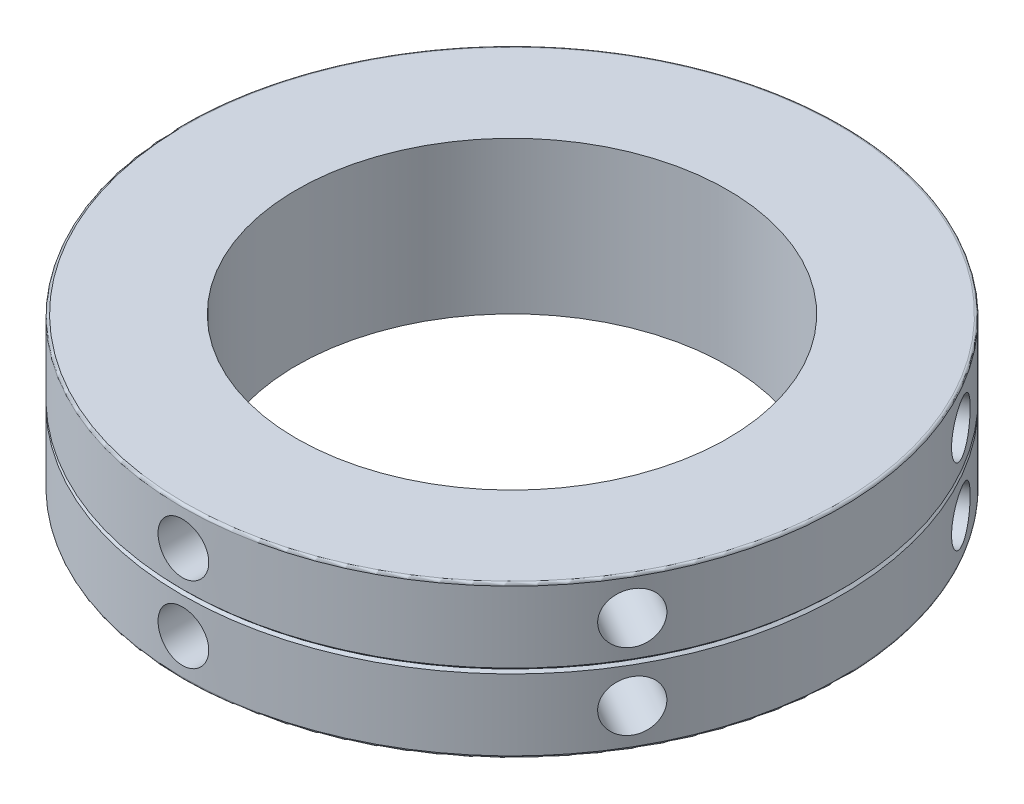
from build123d import *

# Parameters (mm, degrees)
SKETCH1_R                 = 26
SKETCH1_R_2               = 17
BOSS_EXTRUDE1_DEPTH       = 6
FILLET1_R                 = 0.2
CUT_EXTRUDE1_START        = 18
SKETCH4_R                 = 2
CUT_EXTRUDE1_DEPTH        = 12
CIRPATTERN1_COUNT         = 6
LPATTERN1_START           = 18
LPATTERN1_COPY_1_SKETCH_R = 2
LPATTERN1_COPY_1_DEPTH    = 12
LPATTERN1_COPY_2_SKETCH_R = 2
LPATTERN1_COPY_2_DEPTH    = 12
LPATTERN1_COPY_3_SKETCH_R = 2
LPATTERN1_COPY_3_DEPTH    = 12
LPATTERN1_COPY_4_SKETCH_R = 2
LPATTERN1_COPY_4_DEPTH    = 12
LPATTERN1_COPY_5_SKETCH_R = 2
LPATTERN1_COPY_5_DEPTH    = 12
LPATTERN1_COPY_6_SKETCH_R = 2
LPATTERN1_COPY_6_DEPTH    = 12


with BuildPart() as part:
    # Sketch1 → Boss-Extrude1 (new, symmetric)
    with BuildSketch(Plane(origin=(0, 0, 0), x_dir=(1, 0, 0), z_dir=(0, 1, 0))):
        Circle(SKETCH1_R)
        Circle(SKETCH1_R_2, mode=Mode.SUBTRACT)
    extrude(amount=BOSS_EXTRUDE1_DEPTH, both=True)

    # Sketch3 → Cut-Revolve1 (revolve, cut)
    with BuildSketch(Plane.XY):
        Polygon((-26, 0.2), (-26, -0.2), (-25.8, 0), align=None)
    revolve(axis=Axis((0, -6, 0), (0, 1, 0)), mode=Mode.SUBTRACT)

    # Fillet1
    fillet1_edges = [part.edges().sort_by_distance(p)[0] for p in [
        (-26, -6, 0),
        (-26, 6, 0),
    ]]
    fillet(fillet1_edges, radius=FILLET1_R)

    # Sketch4 → Cut-Extrude1 (cut)
    with BuildSketch(Plane.XY.offset(CUT_EXTRUDE1_START)):
        with Locations((0, 3)):
            Circle(SKETCH4_R)
    cut_extrude1 = extrude(amount=CUT_EXTRUDE1_DEPTH, mode=Mode.SUBTRACT)

    # CirPattern1: Cut-Extrude1 ×6 about axis
    cirpattern1_axis = Axis((0, 6, 0), (0, -1, 0))
    for i in range(1, CIRPATTERN1_COUNT):
        add(cut_extrude1.rotate(cirpattern1_axis, i * 360 / CIRPATTERN1_COUNT), mode=Mode.SUBTRACT)

    # LPattern1 copy 1 sketch → LPattern1 copy 1 (cut)
    with BuildSketch(Plane(origin=(0, -6, 0), x_dir=(0.5000000000000001, 0, 0.8660254037844386), z_dir=(-0.8660254037844386, 0, 0.5000000000000001)).offset(LPATTERN1_START)):
        with Locations((0, 3)):
            Circle(LPATTERN1_COPY_1_SKETCH_R)
    extrude(amount=LPATTERN1_COPY_1_DEPTH, mode=Mode.SUBTRACT)

    # LPattern1 copy 2 sketch → LPattern1 copy 2 (cut)
    with BuildSketch(Plane(origin=(0, -6, 0), x_dir=(-0.4999999999999998, 0, 0.8660254037844387), z_dir=(-0.8660254037844387, 0, -0.4999999999999998)).offset(LPATTERN1_START)):
        with Locations((0, 3)):
            Circle(LPATTERN1_COPY_2_SKETCH_R)
    extrude(amount=LPATTERN1_COPY_2_DEPTH, mode=Mode.SUBTRACT)

    # LPattern1 copy 3 sketch → LPattern1 copy 3 (cut)
    with BuildSketch(Plane(origin=(0, -6, 0), x_dir=(-1, 0, 0), z_dir=(0, 0, -1)).offset(LPATTERN1_START)):
        with Locations((0, 3)):
            Circle(LPATTERN1_COPY_3_SKETCH_R)
    extrude(amount=LPATTERN1_COPY_3_DEPTH, mode=Mode.SUBTRACT)

    # LPattern1 copy 4 sketch → LPattern1 copy 4 (cut)
    with BuildSketch(Plane(origin=(0, -6, 0), x_dir=(-0.5000000000000004, 0, -0.8660254037844384), z_dir=(0.8660254037844384, 0, -0.5000000000000004)).offset(LPATTERN1_START)):
        with Locations((0, 3)):
            Circle(LPATTERN1_COPY_4_SKETCH_R)
    extrude(amount=LPATTERN1_COPY_4_DEPTH, mode=Mode.SUBTRACT)

    # LPattern1 copy 5 sketch → LPattern1 copy 5 (cut)
    with BuildSketch(Plane(origin=(0, -6, 0), x_dir=(0.5000000000000001, 0, -0.8660254037844386), z_dir=(0.8660254037844386, 0, 0.5000000000000001)).offset(LPATTERN1_START)):
        with Locations((0, 3)):
            Circle(LPATTERN1_COPY_5_SKETCH_R)
    extrude(amount=LPATTERN1_COPY_5_DEPTH, mode=Mode.SUBTRACT)

    # LPattern1 copy 6 sketch → LPattern1 copy 6 (cut)
    with BuildSketch(Plane(origin=(0, -6, 0), x_dir=(1, 0, 0), z_dir=(0, 0, 1)).offset(LPATTERN1_START)):
        with Locations((0, 3)):
            Circle(LPATTERN1_COPY_6_SKETCH_R)
    extrude(amount=LPATTERN1_COPY_6_DEPTH, mode=Mode.SUBTRACT)


solid = part.part
